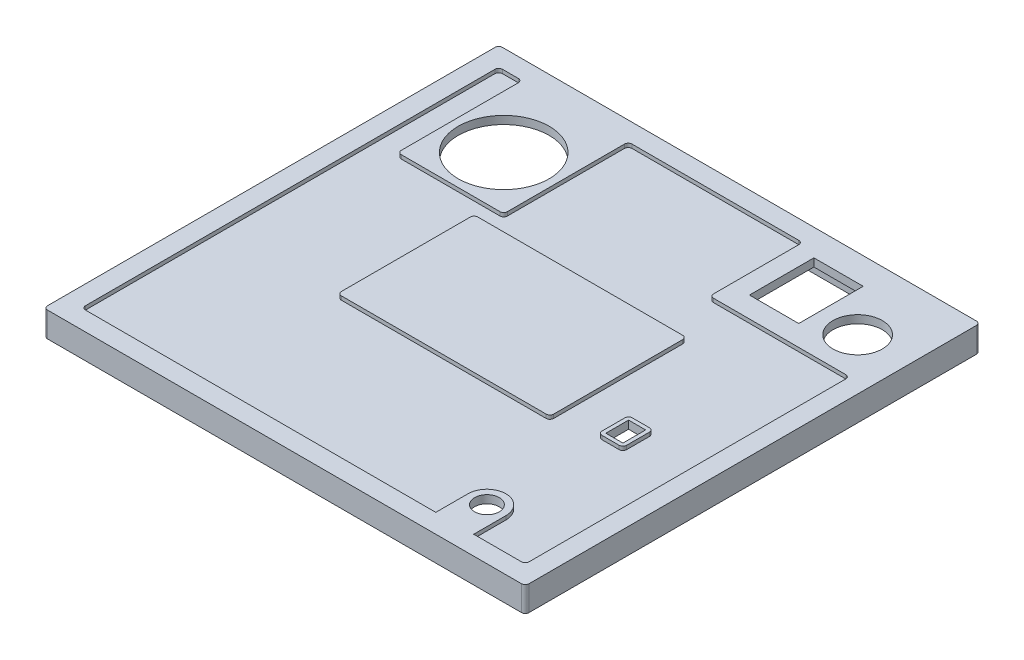
from build123d import *

# Parameters (mm, degrees)
CROQUIS1_W                 = 127
CROQUIS1_H                 = 120
SALIENTE_EXTRUIR1_DEPTH    = 4.6
CROQUIS2_W                 = 115
CROQUIS2_H                 = 108
CORTAR_EXTRUIR1_DEPTH      = 2.5
CROQUIS4_R                 = 3.25
CORTAR_EXTRUIR2_DEPTH      = 5
CROQUIS5_R                 = 6.5
CORTAR_EXTRUIR3_DEPTH      = 5
CROQUIS9_W                 = 13
CROQUIS9_H                 = 17
CORTAR_EXTRUIR5_DEPTH      = 5
CORTAR_EXTRUIR7_DEPTH      = 1
CORTAR_EXTRUIR8_DEPTH      = 10
CORTAR_EXTRUIR8_DEPTH_BACK = 10
CROQUIS12_R                = 12
SALIENTE_EXTRUIR3_START    = 1
CROQUIS14_W                = 28
CROQUIS14_H                = 32.85
CROQUIS14_R                = 12
SALIENTE_EXTRUIR3_DEPTH    = 1
REDONDEO4_RADIUS           = 5
REDONDEO4_LENGTH           = 1
CROQUIS11_W                = 56
CROQUIS11_H                = 36
SALIENTE_EXTRUIR2_DEPTH    = 1
REDONDEO6_R                = 1
REDONDEO7_R                = 1
CROQUIS15_W                = 127
CROQUIS15_H                = 120
CROQUIS15_W_2              = 124
CROQUIS15_H_2              = 117
SALIENTE_EXTRUIR4_DEPTH    = 2
CROQUIS16_W                = 4.5
CROQUIS16_H                = 6
CORTAR_EXTRUIR9_DEPTH      = 20
CROQUIS18_W                = 6.5
CROQUIS18_H                = 8
CROQUIS18_W_2              = 4.5
CROQUIS18_H_2              = 6
SALIENTE_EXTRUIR5_DEPTH    = 1
REDONDEO8_R                = 1
REDONDEO9_R                = 1


with BuildPart() as part:
    # Croquis1 → Saliente-Extruir1 (new body)
    with BuildSketch(Plane(origin=(0, 0, 0), x_dir=(1, 0, 0), z_dir=(0, 1, 0))):
        with Locations((14.639221557, -30.531437126)):
            Rectangle(CROQUIS1_W, CROQUIS1_H)
    extrude(amount=SALIENTE_EXTRUIR1_DEPTH)

    # Croquis2 → Cortar-Extruir1 (cut)
    with BuildSketch(Plane.XZ):
        with Locations((14.639221557, 30.531437126)):
            Rectangle(CROQUIS2_W, CROQUIS2_H)
    extrude(amount=-CORTAR_EXTRUIR1_DEPTH, mode=Mode.SUBTRACT)

    # Croquis4 → Cortar-Extruir2 (cut)
    with BuildSketch(Plane.XZ.offset(-2.5)):
        with Locations(Location((54.539221557, 77.041437126, 0), (0, 0, 270))):
            Circle(CROQUIS4_R)
    extrude(amount=-CORTAR_EXTRUIR2_DEPTH, mode=Mode.SUBTRACT)

    # Croquis5 → Cortar-Extruir3 (cut)
    with BuildSketch(Plane.XZ.offset(-2.5)):
        with Locations(Location((64.609221557, -10.668562874, 0), (0, 0, 270))):
            Circle(CROQUIS5_R)
    extrude(amount=-CORTAR_EXTRUIR3_DEPTH, mode=Mode.SUBTRACT)

    # Croquis9 → Cortar-Extruir5 (cut)
    with BuildSketch(Plane(origin=(0, 2.5, 0), x_dir=(-1, 0, 0), z_dir=(0, -1, 0))):
        with Locations((-47.769221557, 13.968562874)):
            Rectangle(CROQUIS9_W, CROQUIS9_H)
    extrude(amount=-CORTAR_EXTRUIR5_DEPTH, mode=Mode.SUBTRACT)

    # Croquis10 → Cortar-Extruir7 (cut)
    with BuildSketch(Plane(origin=(0, 4.6, 0), x_dir=(1, 0, 0), z_dir=(0, 1, 0))):
        Polygon((-43.860778443, 24.468562874), (36.269221557, 24.468562874), (36.269221557, 0), (73.139221557, 0), (73.139221557, -73.041437126), (73.139221557, -85.531437126), (59.539221557, -85.531437126), (59.539221557, -72.041437126), (49.539221557, -72.041437126), (49.539221557, -85.531437126), (-43.860778443, -85.531437126), align=None)
    extrude(amount=-CORTAR_EXTRUIR7_DEPTH, mode=Mode.SUBTRACT)

    # Croquis12 → Cortar-Extruir8 (cut, two sides: drawn at the far end of the back side and taken through both)
    with BuildSketch(Plane(origin=(0, 3.6, 0), x_dir=(1, 0, 0), z_dir=(0, 1, 0)).offset(-CORTAR_EXTRUIR8_DEPTH_BACK)):
        with Locations(Location((-23.700778443, 5.618562874, 0), (0, 0, 90))):
            Circle(CROQUIS12_R)
    extrude(amount=CORTAR_EXTRUIR8_DEPTH + CORTAR_EXTRUIR8_DEPTH_BACK, mode=Mode.SUBTRACT)

    # Croquis14 → Saliente-Extruir3 (add)
    with BuildSketch(Plane(origin=(0, 3.6, 0), x_dir=(1, 0, 0), z_dir=(0, 1, 0)).offset(SALIENTE_EXTRUIR3_START)):
        with Locations((-23.700778443, 8.043562874)):
            Rectangle(CROQUIS14_W, CROQUIS14_H)
        with Locations((-23.700778443, 5.618562874)):
            Circle(CROQUIS14_R, mode=Mode.SUBTRACT)
    extrude(amount=-SALIENTE_EXTRUIR3_DEPTH)

    # Redondeo4: full round fillet: the end face becomes a half cylinder, R = half its width
    redondeo4_face = Plane((54.539221557, 4.1, 72.041437126), x_dir=(0, -1, 0), z_dir=(0, 0, -1))  # on the end face: x along it, z out of the body
    redondeo4_slab = redondeo4_face.offset(-REDONDEO4_RADIUS / 2) * Box(REDONDEO4_LENGTH, 2 * REDONDEO4_RADIUS, REDONDEO4_RADIUS, mode=Mode.PRIVATE)  # the body's end, R deep
    redondeo4_round = Plane((54.539221557, 4.1, 77.041437126), x_dir=(0, 0, -1), z_dir=(0, -1, 0)) * Cylinder(REDONDEO4_RADIUS, REDONDEO4_LENGTH, mode=Mode.PRIVATE)  # its axis R under the face
    add(redondeo4_slab - redondeo4_round, mode=Mode.SUBTRACT)

    # Croquis11 → Saliente-Extruir2 (add)
    with BuildSketch(Plane(origin=(0, 3.6, 0), x_dir=(1, 0, 0), z_dir=(0, 1, 0))):
        with Locations((14.639221557, -30.531437126)):
            Rectangle(CROQUIS11_W, CROQUIS11_H)
    extrude(amount=SALIENTE_EXTRUIR2_DEPTH)

    # Redondeo6
    redondeo6_edges = [part.edges().sort_by_distance(p)[0] for p in [
        (-13.360778443, 4.1, 12.531437126),
        (-13.360778443, 4.1, 48.531437126),
        (42.639221557, 4.1, 48.531437126),
        (42.639221557, 4.1, 12.531437126),
        (-43.860778443, 4.1, 85.531437126),
        (-43.860778443, 4.1, -24.468562874),
        (36.269221557, 4.1, -24.468562874),
        (36.269221557, 4.1, 0),
        (73.139221557, 4.1, 0),
        (73.139221557, 4.1, 85.531437126),
    ]]
    fillet(redondeo6_edges, radius=REDONDEO6_R)

    # Redondeo7
    redondeo7_edges = [part.edges().sort_by_distance(p)[0] for p in [
        (-9.700778443, 4.1, 8.381437126),
        (-9.700778443, 4.1, -24.468562874),
        (-37.700778443, 4.1, -24.468562874),
        (-37.700778443, 4.1, 8.381437126),
    ]]
    fillet(redondeo7_edges, radius=REDONDEO7_R)

    # Croquis15 → Saliente-Extruir4 (add)
    with BuildSketch(Plane(origin=(0, 0, 0), x_dir=(-1, 0, 0), z_dir=(0, -1, 0))):
        with Locations((-14.639221557, -30.531437126)):
            Rectangle(CROQUIS15_W, CROQUIS15_H)
        with Locations((-14.639221557, -30.531437126)):
            Rectangle(CROQUIS15_W_2, CROQUIS15_H_2, mode=Mode.SUBTRACT)
    extrude(amount=SALIENTE_EXTRUIR4_DEPTH)

    # Croquis16 → Cortar-Extruir9 (cut)
    with BuildSketch(Plane(origin=(0, 3.6, 0), x_dir=(1, 0, 0), z_dir=(0, 1, 0))):
        with Locations((56.139221557, -42.031437126)):
            Rectangle(CROQUIS16_W, CROQUIS16_H)
    extrude(amount=-CORTAR_EXTRUIR9_DEPTH, mode=Mode.SUBTRACT)

    # Croquis18 → Saliente-Extruir5 (add)
    with BuildSketch(Plane(origin=(0, 3.6, 0), x_dir=(1, 0, 0), z_dir=(0, 1, 0))):
        with Locations((56.139221557, -42.031437126)):
            Rectangle(CROQUIS18_W, CROQUIS18_H)
        with Locations((56.139221557, -42.031437126)):
            Rectangle(CROQUIS18_W_2, CROQUIS18_H_2, mode=Mode.SUBTRACT)
    extrude(amount=SALIENTE_EXTRUIR5_DEPTH)

    # Redondeo8
    redondeo8_edges = [part.edges().sort_by_distance(p)[0] for p in [
        (59.389221557, 4.1, 46.031437126),
        (59.389221557, 4.1, 38.031437126),
        (52.889221557, 4.1, 38.031437126),
        (52.889221557, 4.1, 46.031437126),
    ]]
    fillet(redondeo8_edges, radius=REDONDEO8_R)

    # Redondeo9
    redondeo9_edges = [part.edges().sort_by_distance(p)[0] for p in [
        (-48.860778443, 1.3, -29.468562874),
        (78.139221557, 1.3, -29.468562874),
        (78.139221557, 1.3, 90.531437126),
        (-48.860778443, 1.3, 90.531437126),
    ]]
    fillet(redondeo9_edges, radius=REDONDEO9_R)


solid = part.part
